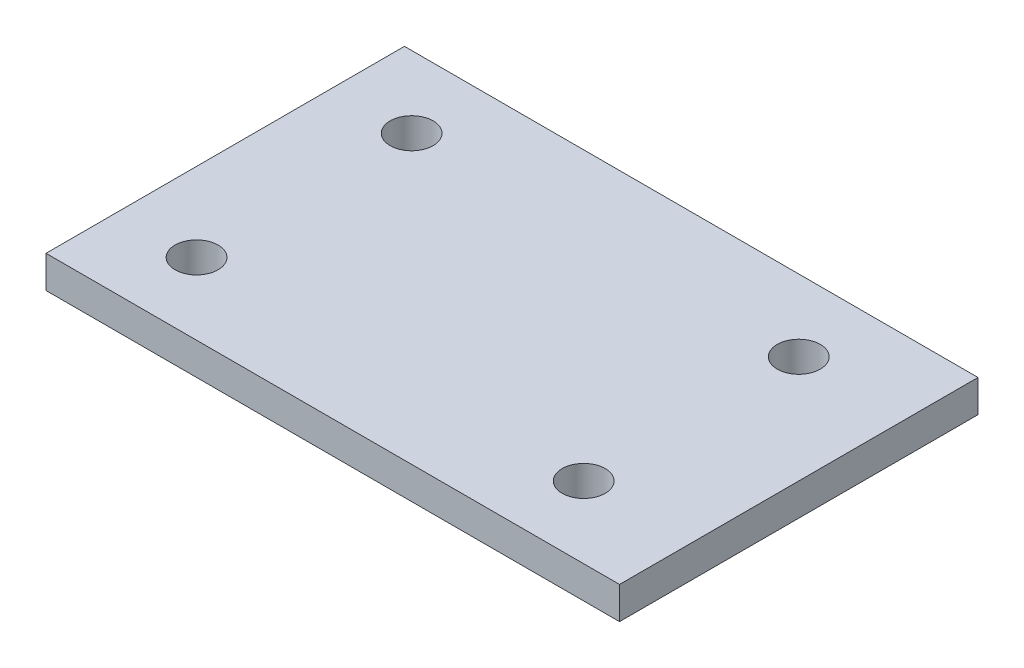
from build123d import *

# Parameters (mm, degrees)
SKETCH1_W           = 80
SKETCH1_H           = 50
BOSS_EXTRUDE1_DEPTH = 4.5
SKETCH2_R           = 3
CUT_EXTRUDE1_DEPTH  = 4.5
SKETCH3_R           = 3
CUT_EXTRUDE2_DEPTH  = 10


with BuildPart() as part:
    # Sketch1 → Boss-Extrude1 (new body)
    with BuildSketch(Plane(origin=(0, 0, 0), x_dir=(1, 0, 0), z_dir=(0, 1, 0))):
        with Locations((40, 25)):
            Rectangle(SKETCH1_W, SKETCH1_H)
    extrude(amount=BOSS_EXTRUDE1_DEPTH)

    # Sketch2 → Cut-Extrude1 (cut)
    with BuildSketch(Plane(origin=(0, 4.5, 0), x_dir=(1, 0, 0), z_dir=(0, 1, 0))):
        with Locations(Location((65, 40, 0), (0, 0, 270))):
            Circle(SKETCH2_R)
        with Locations(Location((65, 10, 0), (0, 0, 270))):
            Circle(SKETCH2_R)
    extrude(amount=-CUT_EXTRUDE1_DEPTH, mode=Mode.SUBTRACT)

    # Sketch3 → Cut-Extrude2 (cut)
    with BuildSketch(Plane(origin=(0, 4.5, 0), x_dir=(1, 0, 0), z_dir=(0, 1, 0))):
        with Locations(Location((11, 40, 0), (0, 0, 270))):
            Circle(SKETCH3_R)
        with Locations(Location((11, 10, 0), (0, 0, 270))):
            Circle(SKETCH3_R)
    extrude(amount=-CUT_EXTRUDE2_DEPTH, mode=Mode.SUBTRACT)


solid = part.part
